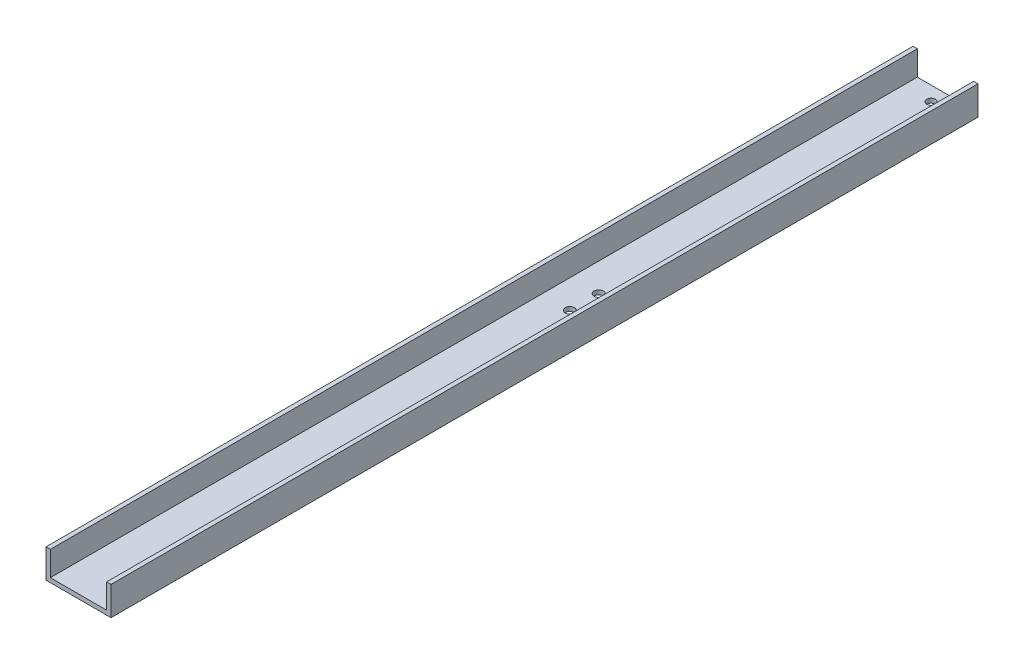
from build123d import *

# Parameters (mm, degrees)
BOSS_EXTRU_1_DEPTH                  = 300
ESQUISSE2_R                         = 1.6
ENL_V_MAT_EXTRU_1_DEPTH             = 301.377366824
F_3_0_3_DURCHMESSER_LANGLOCH1_D     = 3
F_3_0_3_DURCHMESSER_LANGLOCH1_DEPTH = 12.5
F_3_0_3_DURCHMESSER_LANGLOCH1_TIP   = 0.901290929


with BuildPart() as part:
    # Esquisse1 → Boss.-Extru.1 (new body)
    with BuildSketch(Plane.XY):
        Polygon((-11.25, 0), (11.25, 0), (11.25, 10), (9.75, 10), (9.75, 1.5), (-9.75, 1.5), (-9.75, 10), (-11.25, 10), align=None)
    extrude(amount=BOSS_EXTRU_1_DEPTH)

    # Esquisse2 → Enlèv. mat.-Extru.1 (cut, through all)
    with BuildSketch(Plane.XZ):
        with Locations(Location((0, 120, 0), (0, 0, 270))):
            Circle(ESQUISSE2_R)
        with Locations(Location((0, 130, 0), (0, 0, 270))):
            Circle(ESQUISSE2_R)
    extrude(amount=-ENL_V_MAT_EXTRU_1_DEPTH, mode=Mode.SUBTRACT)

    # Ø3.0 (3) Durchmesser Langloch1
    with Locations(Plane(origin=(0, 0, 0), x_dir=(-1, 0, 0), z_dir=(0, -1, 0))):
        with Locations((0, -5)):
            Hole(F_3_0_3_DURCHMESSER_LANGLOCH1_D / 2, depth=F_3_0_3_DURCHMESSER_LANGLOCH1_DEPTH)
            with Locations((0, 0, -(F_3_0_3_DURCHMESSER_LANGLOCH1_DEPTH + F_3_0_3_DURCHMESSER_LANGLOCH1_TIP / 2))):  # 118° drill point
                Cone(0, F_3_0_3_DURCHMESSER_LANGLOCH1_D / 2, F_3_0_3_DURCHMESSER_LANGLOCH1_TIP, mode=Mode.SUBTRACT)


solid = part.part
